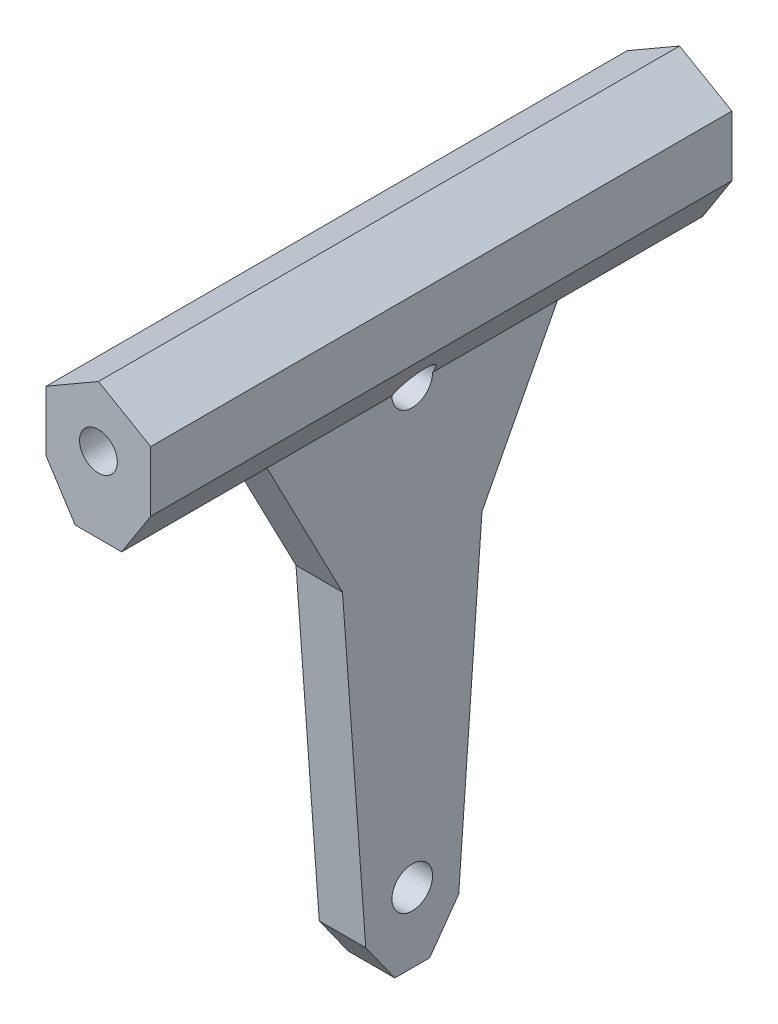
from build123d import *

# Parameters (mm, degrees)
SKETCH_1_R               = 3.25
EXTRUDE_1_DEPTH          = 100
CUT_EXTRUDE_1_DEPTH      = 143.017604543
CUT_EXTRUDE_1_DEPTH_BACK = 143.017604543
SKETCH_2_R               = 3.5


with BuildPart() as part:
    # 草圖1 → 填料-伸長1 (new body)
    with BuildSketch(Plane.XY):
        Polygon((-9, 5.196152423), (-9, -5.196152423), (-4, -13), (-4, -100), (4, -100), (4, -13), (9, -5.196152423), (9, 5.196152423), (0, 10.392304845), align=None)
        Circle(SKETCH_1_R, mode=Mode.SUBTRACT)
    extrude(amount=EXTRUDE_1_DEPTH)

    # 草圖2 → 除料-伸長1 (cut, two sides: drawn at the far end of the back side and taken through both)
    with BuildSketch(Plane.ZY.offset(4).offset(-CUT_EXTRUDE_1_DEPTH_BACK)):
        Polygon((25, -13), (0, -13), (0, -100), (47, -100), (42, -93), (38, -38), align=None)
        Polygon((58, -93), (53, -100), (100, -100), (100, -13), (75, -13), (62, -38), align=None)
        Polygon((14.096436709, -107.454844565), (0, -100), (100, -100), (75.233428016, -107.454844565), align=None)
        with BuildLine():
            Line((53.5, -13), (46.5, -13))
            ThreePointArc((46.5, -13), (50, -16.5), (53.5, -13))
        make_face()
        with BuildLine():
            ThreePointArc((53.5, -13), (50, -9.5), (46.5, -13))
            Line((46.5, -13), (53.5, -13))
        make_face()
        with Locations(Location((50, -88, 0), (0, 0, 270))):
            Circle(SKETCH_2_R)
    extrude(amount=CUT_EXTRUDE_1_DEPTH + CUT_EXTRUDE_1_DEPTH_BACK, mode=Mode.SUBTRACT)


solid = part.part
